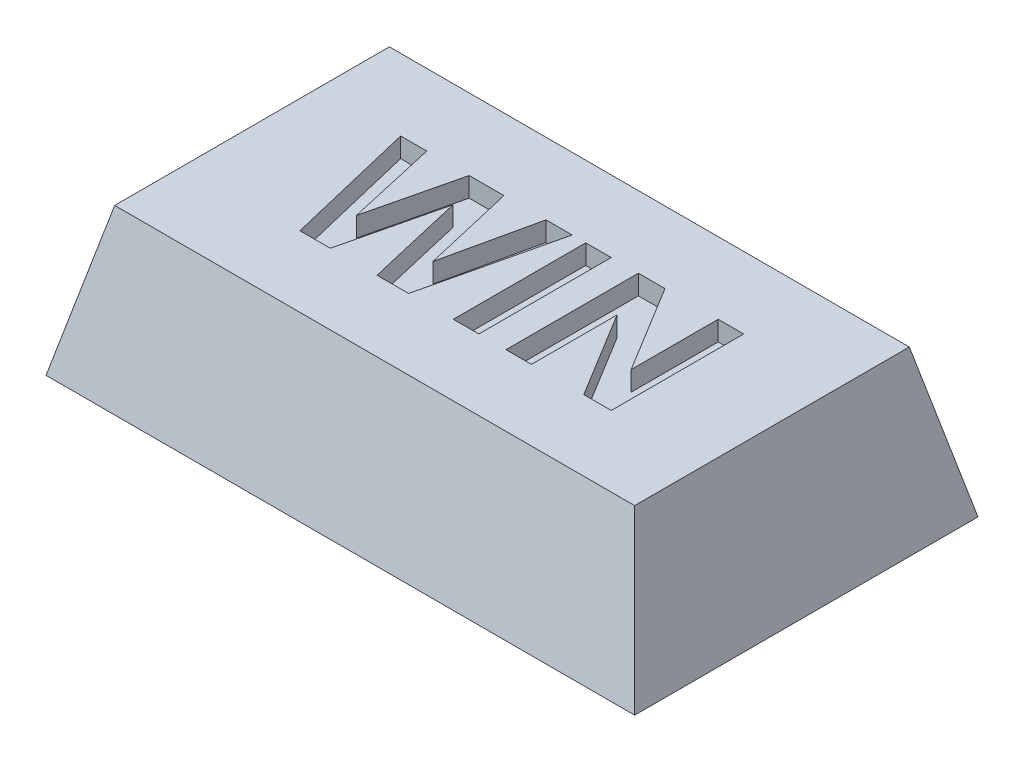
from build123d import *

# Parameters (mm, degrees)
SKETCH1_W               = 12
SKETCH1_H               = 7
BOSS_EXTRUDE1_DEPTH     = 3
CUT_EXTRUDE1_DEPTH      = 7
CUT_EXTRUDE2_DEPTH      = 15.212670404
CUT_EXTRUDE2_DEPTH_BACK = 15.212670404
SKETCH4_R               = 1.8
CUT_EXTRUDE3_DEPTH      = 0.8
SKETCH5_W               = 0.519230769
SKETCH5_H               = 2.7
CUT_EXTRUDE4_DEPTH      = 0.4


with BuildPart() as part:
    # Sketch1 → Boss-Extrude1 (new body)
    with BuildSketch(Plane(origin=(0, 0, 0), x_dir=(1, 0, 0), z_dir=(0, 1, 0))):
        with Locations((6, 3.5)):
            Rectangle(SKETCH1_W, SKETCH1_H)
    extrude(amount=BOSS_EXTRUDE1_DEPTH)

    # Sketch2 → Cut-Extrude1 (cut)
    with BuildSketch(Plane.XY):
        Polygon((0, 0), (0.7, 3), (0, 3), align=None)
        Polygon((12, 0), (11.3, 3), (12, 3), align=None)
    extrude(amount=-CUT_EXTRUDE1_DEPTH, mode=Mode.SUBTRACT)

    # Sketch3 → Cut-Extrude2 (cut, two sides: drawn at the far end of the back side and taken through both)
    with BuildSketch(Plane(origin=(0, 0, 0), x_dir=(0, 0, -1), z_dir=(1, 0, 0)).offset(-CUT_EXTRUDE2_DEPTH_BACK)):
        Polygon((0, 0), (0.7, 3), (0, 3), align=None)
        Polygon((7, 3), (6.3, 3), (7, 0), align=None)
    extrude(amount=CUT_EXTRUDE2_DEPTH + CUT_EXTRUDE2_DEPTH_BACK, mode=Mode.SUBTRACT)

    # Sketch4 → Cut-Extrude3 (cut)
    with BuildSketch(Plane.XZ):
        with Locations(Location((6, -3.5, 0), (0, 0, 270))):
            Circle(SKETCH4_R)
    extrude(amount=-CUT_EXTRUDE3_DEPTH, mode=Mode.SUBTRACT)

    # Sketch5 → Cut-Extrude4 (cut)
    with BuildSketch(Plane(origin=(0, 3, 0), x_dir=(1, 0, 0), z_dir=(0, 1, 0))):
        Polygon((3.035523477, 2.141483951), (2.389189343, 4.841483951), (2.921400881, 4.841483951), (3.341112419, 2.986856547), (3.7851629, 4.841483951), (4.493696554, 4.841483951), (4.933420112, 2.955486355), (5.352049919, 4.841483951), (5.885343189, 4.841483951), (5.250908093, 2.141483951), (4.60781915, 2.141483951), (4.137266266, 4.159993566), (3.654273477, 2.141483951), align=None)
        with Locations((6.421881651, 3.491483951)):
            Rectangle(SKETCH5_W, SKETCH5_H)
        Polygon((7.235343189, 2.141483951), (7.235343189, 4.841483951), (7.777831169, 4.841483951), (8.862266266, 3.066363758), (8.862266266, 4.841483951), (9.381497035, 4.841483951), (9.381497035, 2.141483951), (8.822242227, 2.141483951), (7.754573958, 3.888479143), (7.754573958, 2.141483951), align=None)
    extrude(amount=-CUT_EXTRUDE4_DEPTH, mode=Mode.SUBTRACT)


solid = part.part
